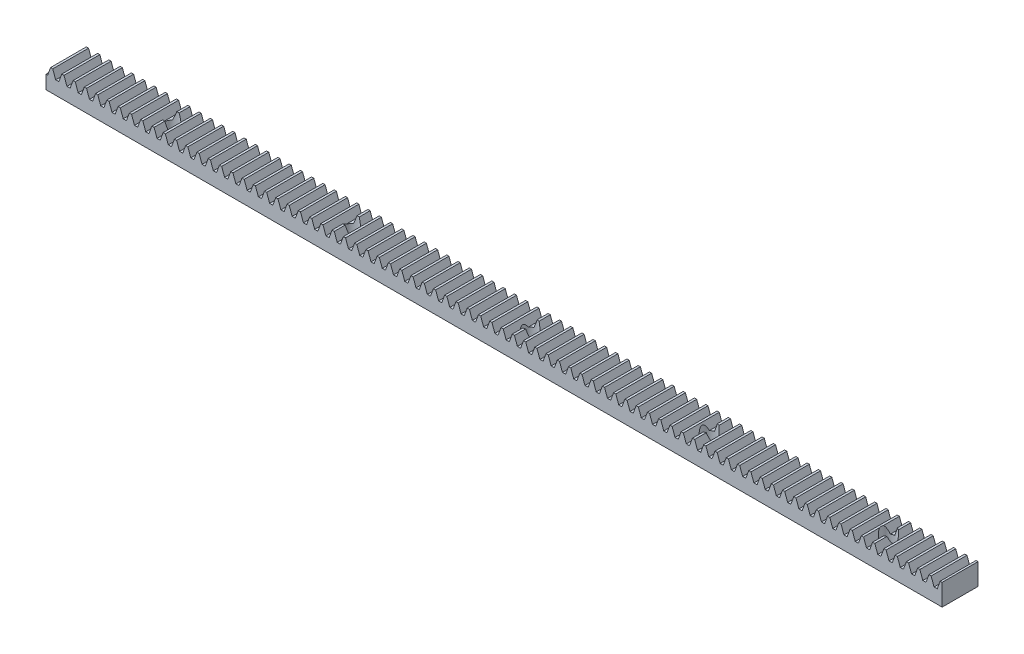
from build123d import *

# Parameters (mm, degrees)
BLANKSKE_W          = 300
BLANKSKE_H          = 6
BLANK_DEPTH         = 10
TOOTHCUTSIM_DEPTH   = 301.226581102
TEETHCUTS_COUNT     = 96
TEETHCUTS_PITCH     = 3.14159265
SKETCH_1_R          = 2
CUT_EXTRUDE_1_DEPTH = 301.226581102
SKETCH_2_W          = 50
SKETCH_2_H          = 10
CUT_EXTRUDE_2_DEPTH = 10


with BuildPart() as part:
    # BlankSke → Blank (new body)
    with BuildSketch(Plane.XY):
        with Locations((150, 3)):
            Rectangle(BLANKSKE_W, BLANKSKE_H)
    extrude(amount=-BLANK_DEPTH)

    # TooCutSkeSim → ToothCutSim (cut, through all)
    with BuildSketch(Plane.XY):
        Polygon((0.44443537, 3.75), (-0.44443537, 3.75), (-1.272613241, 6.0254), (1.272613241, 6.0254), align=None)
    toothcutsim = extrude(amount=-TOOTHCUTSIM_DEPTH, mode=Mode.SUBTRACT)

    # TeethCuts: ToothCutSim ×96
    with Locations(*[(i * TEETHCUTS_PITCH, 0, 0) for i in range(1, TEETHCUTS_COUNT)]):
        add(toothcutsim, mode=Mode.SUBTRACT)

    # 草图1 → 切除-拉伸1 (cut, through all)
    with BuildSketch(Plane(origin=(0, 0, 0), x_dir=(1, 0, 0), z_dir=(0, 1, 0))):
        with Locations(Location((30, 5, 0), (0, 0, 85.625282885))):
            Circle(SKETCH_1_R)
        with Locations(Location((80, 5, 0), (0, 0, 95.647484784))):
            Circle(SKETCH_1_R)
        with Locations(Location((130, 5, 0), (0, 0, 88.03244733))):
            Circle(SKETCH_1_R)
        with Locations(Location((180, 5, 0), (0, 0, 80.382219369))):
            Circle(SKETCH_1_R)
        with Locations(Location((230, 5, 0), (0, 0, 96.295174022))):
            Circle(SKETCH_1_R)
    extrude(amount=CUT_EXTRUDE_1_DEPTH, mode=Mode.SUBTRACT)

    # 草图2 → 切除-拉伸2 (cut)
    with BuildSketch(Plane(origin=(0, 0, 0), x_dir=(1, 0, 0), z_dir=(0, 1, 0))):
        with Locations((275, 5)):
            Rectangle(SKETCH_2_W, SKETCH_2_H)
    extrude(amount=CUT_EXTRUDE_2_DEPTH, mode=Mode.SUBTRACT)


solid = part.part
